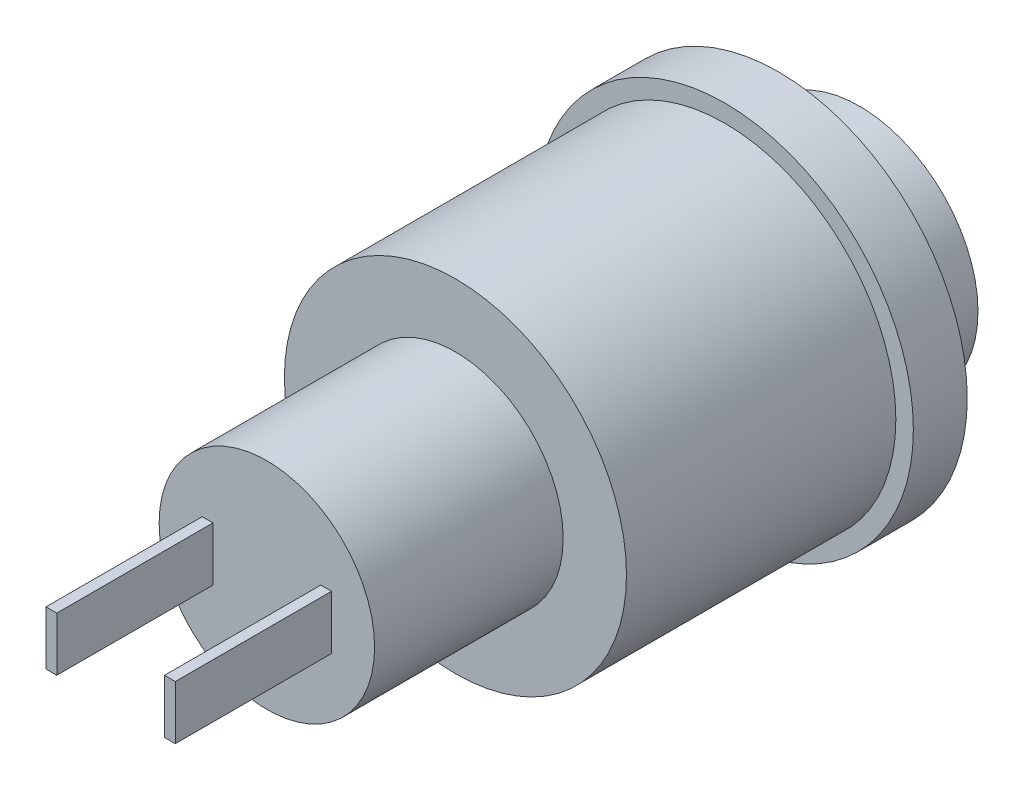
from build123d import *

# Parameters (mm, degrees)
ESQUISSE1_R        = 4.4
BOSS_EXTRU_1_DEPTH = 3
ESQUISSE2_R        = 7
BOSS_EXTRU_2_DEPTH = 2
ESQUISSE3_R        = 6.35
BOSS_EXTRU_3_DEPTH = 10
ESQUISSE4_R        = 4
BOSS_EXTRU_4_DEPTH = 7
ESQUISSE5_W        = 0.4
ESQUISSE5_H        = 2
BOSS_EXTRU_5_DEPTH = 5.8


with BuildPart() as part:
    # Esquisse1 → Boss.-Extru.1 (new body)
    with BuildSketch(Plane.XY):
        Circle(ESQUISSE1_R)
    extrude(amount=BOSS_EXTRU_1_DEPTH)

    # Esquisse2 → Boss.-Extru.2 (add)
    with BuildSketch(Plane.XY.offset(3)):
        Circle(ESQUISSE2_R)
    extrude(amount=BOSS_EXTRU_2_DEPTH)

    # Esquisse3 → Boss.-Extru.3 (add)
    with BuildSketch(Plane.XY.offset(5)):
        Circle(ESQUISSE3_R)
    extrude(amount=BOSS_EXTRU_3_DEPTH)

    # Esquisse4 → Boss.-Extru.4 (add)
    with BuildSketch(Plane.XY.offset(15)):
        Circle(ESQUISSE4_R)
    extrude(amount=BOSS_EXTRU_4_DEPTH)

    # Esquisse5 → Boss.-Extru.5 (add)
    with BuildSketch(Plane.XY.offset(22)):
        with Locations((-2.2, 0)):
            Rectangle(ESQUISSE5_W, ESQUISSE5_H)
        with Locations((2.2, 0)):
            Rectangle(ESQUISSE5_W, ESQUISSE5_H)
    extrude(amount=BOSS_EXTRU_5_DEPTH)


solid = part.part
